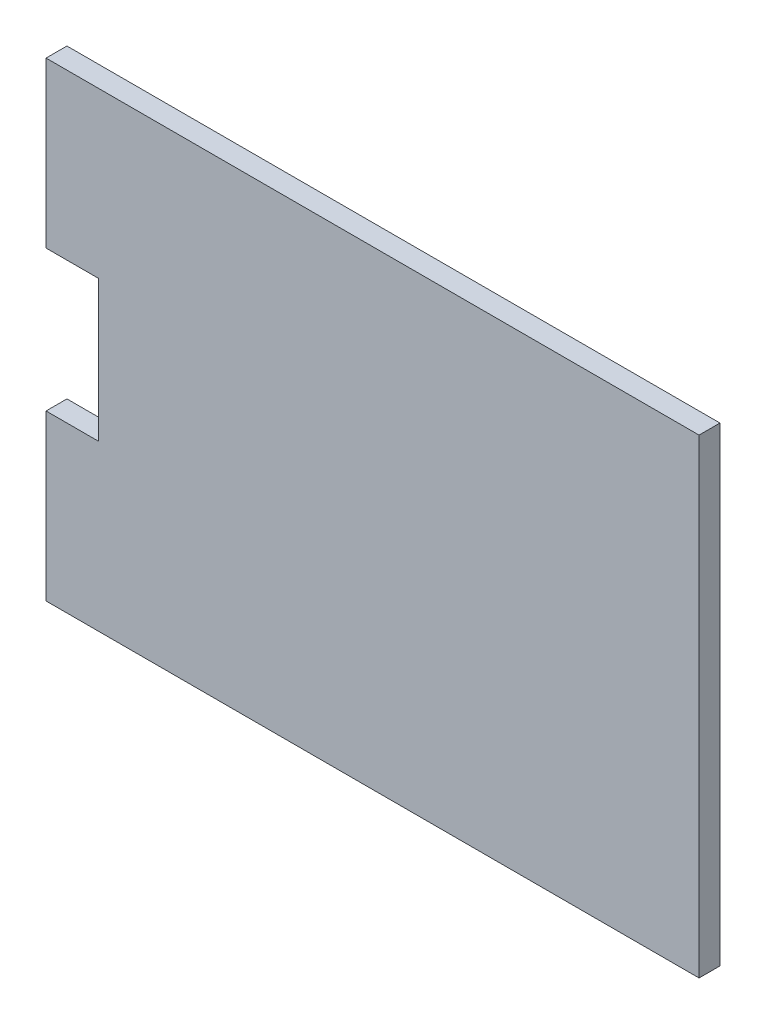
from build123d import *

# Parameters (mm, degrees)
SKETCH_1_W          = 250
SKETCH_1_H          = 180
EXTRUDE_1_DEPTH     = 8
SKETCH_2_W          = 20
SKETCH_2_H          = 54
CUT_EXTRUDE_1_DEPTH = 157.926215359


with BuildPart() as part:
    # 草图1 → 凸台-拉伸1 (new body)
    with BuildSketch(Plane.XY):
        with Locations((-2.658261339, -0.913174946)):
            Rectangle(SKETCH_1_W, SKETCH_1_H)
    extrude(amount=EXTRUDE_1_DEPTH)

    # 草图2 → 切除-拉伸1 (cut, through all)
    with BuildSketch(Plane.XY.offset(8)):
        with Locations((-117.658261339, -0.913174946)):
            Rectangle(SKETCH_2_W, SKETCH_2_H)
    extrude(amount=-CUT_EXTRUDE_1_DEPTH, mode=Mode.SUBTRACT)


solid = part.part
